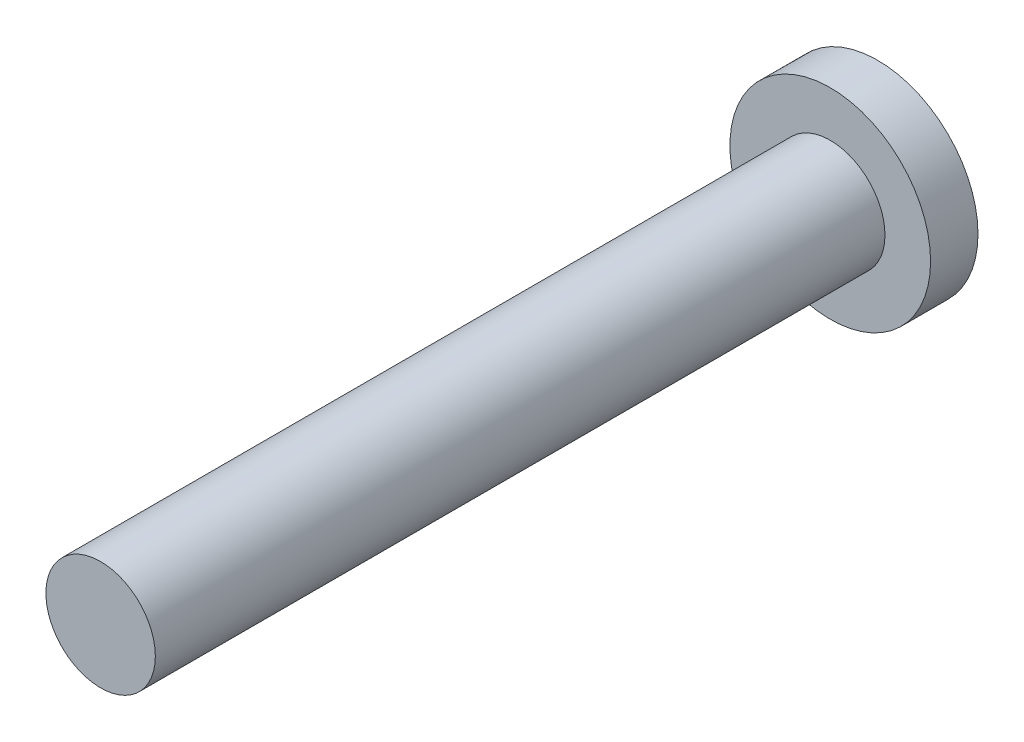
from build123d import *

# Parameters (mm, degrees)
ESQUISSE1_R        = 1.5
BOSS_EXTRU_1_DEPTH = 20
ESQUISSE2_R        = 2.75
BOSS_EXTRU_2_DEPTH = 1.3


with BuildPart() as part:
    # Esquisse1 → Boss.-Extru.1 (new body)
    with BuildSketch(Plane.XY):
        Circle(ESQUISSE1_R)
    extrude(amount=BOSS_EXTRU_1_DEPTH)

    # Esquisse2 → Boss.-Extru.2 (add)
    with BuildSketch(Plane.XY):
        Circle(ESQUISSE2_R)
    extrude(amount=-BOSS_EXTRU_2_DEPTH)


solid = part.part
